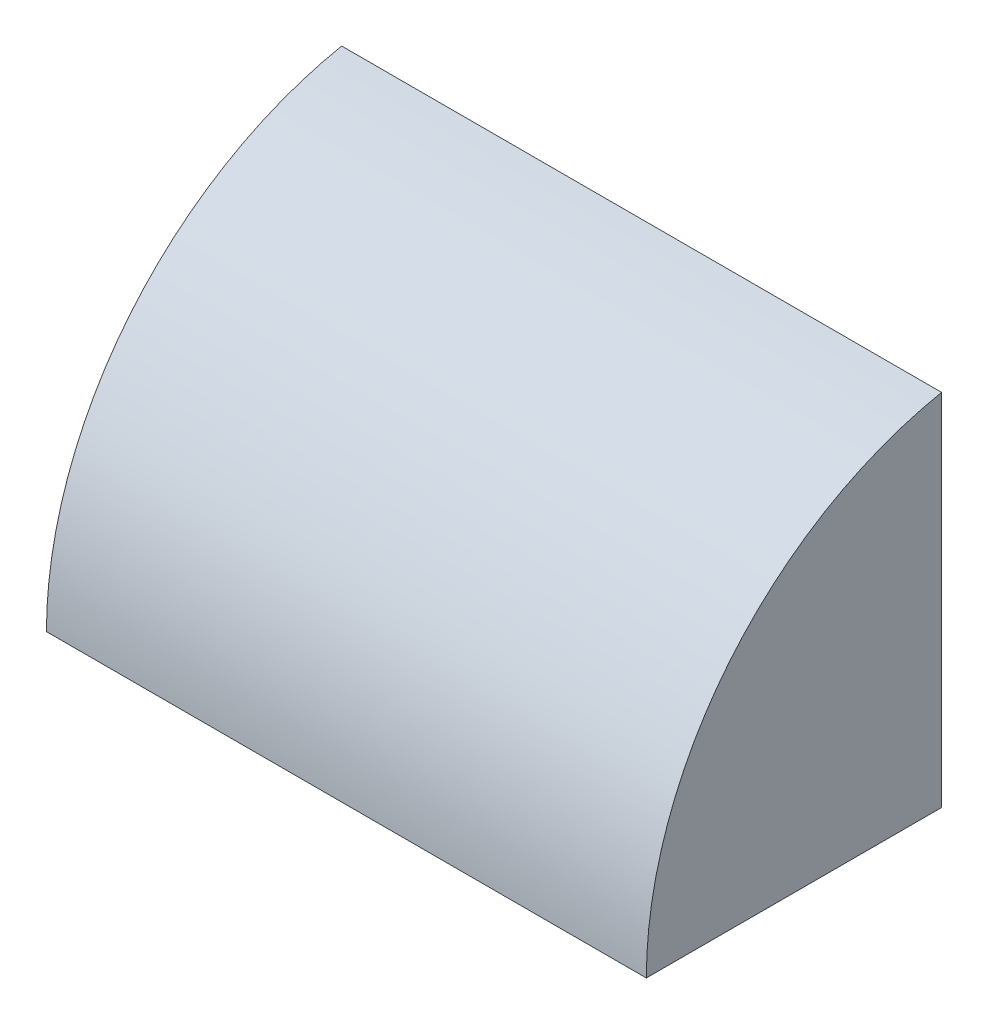
from build123d import *

# Parameters (mm, degrees)
BOSS_EXTRUDE1_DEPTH = 15.85
SHELL1_T            = -1.5


with BuildPart() as part:
    # Sketch1 → Boss-Extrude1 (new body)
    with BuildSketch(Plane(origin=(0, 0, 0), x_dir=(0, 0, -1), z_dir=(1, 0, 0))):
        with BuildLine():
            Line((0, 9.5), (0, 0))
            Line((0, 0), (-7.8, 0))
            ThreePointArc((-7.8, 0), (-5.600175557, 6.145933615), (0, 9.5))
        make_face()
    extrude(amount=-BOSS_EXTRUDE1_DEPTH)

    # Shell1
    shell1_openings = [part.faces().sort_by_distance(p)[0] for p in [
        (-7.925, 0, 3.9),
    ]]
    offset(amount=SHELL1_T, openings=shell1_openings, kind=Kind.INTERSECTION)


solid = part.part
